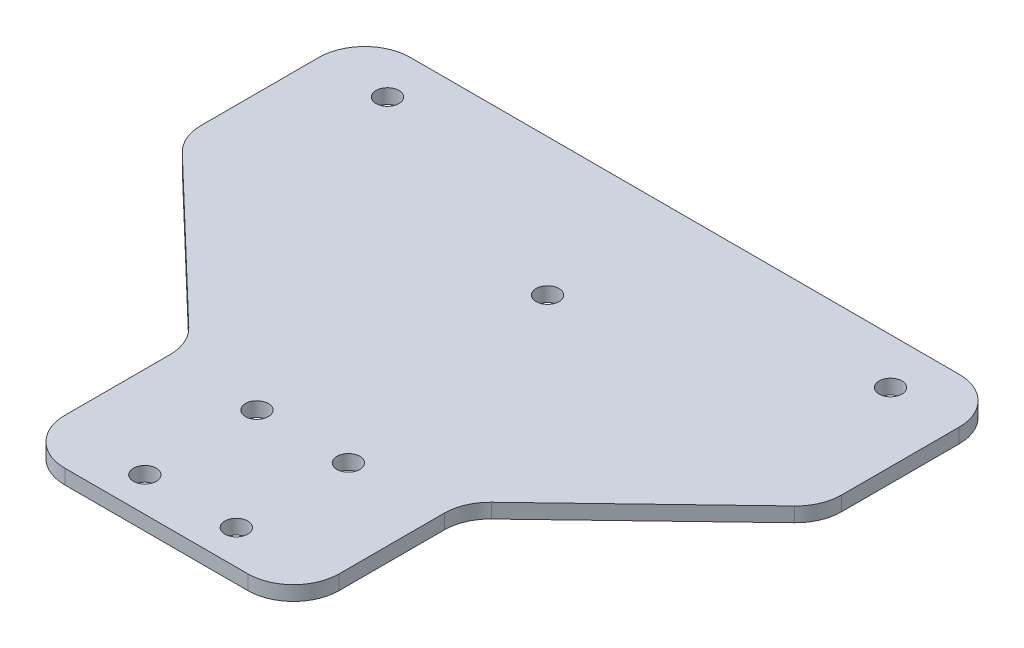
from build123d import *

# Parameters (mm, degrees)
SKETCH1_R           = 2.5
BOSS_EXTRUDE1_DEPTH = 3.18
CUT_EXTRUDE1_DEPTH  = 147.499595989
FILLET1_R           = 10


with BuildPart() as part:
    # Sketch1 → Boss-Extrude1 (new body)
    with BuildSketch(Plane(origin=(0, 0, 0), x_dir=(1, 0, 0), z_dir=(0, 1, 0))):
        Polygon((0, 0), (40, 0), (90, 0), (90, 40), (90, 75.550937794), (90, 115.550937794), (-50, 115.550937794), (-50, 0), align=None)
        with Locations(Location((-35, 105.550937794, 0), (0, 0, 90))):
            Circle(SKETCH1_R, mode=Mode.SUBTRACT)
        with Locations(Location((75, 105.550937794, 0), (0, 0, 90))):
            Circle(SKETCH1_R, mode=Mode.SUBTRACT)
        with Locations(Location((20, 85.550937794, 0), (0, 0, 90))):
            Circle(SKETCH1_R, mode=Mode.SUBTRACT)
        with Locations(Location((10, 7.5, 0), (0, 0, 90))):
            Circle(SKETCH1_R, mode=Mode.SUBTRACT)
        with Locations(Location((30, 7.5, 0), (0, 0, 90))):
            Circle(SKETCH1_R, mode=Mode.SUBTRACT)
        with Locations(Location((10, 32, 0), (0, 0, 90))):
            Circle(SKETCH1_R, mode=Mode.SUBTRACT)
        with Locations(Location((30, 32, 0), (0, 0, 90))):
            Circle(SKETCH1_R, mode=Mode.SUBTRACT)
    extrude(amount=BOSS_EXTRUDE1_DEPTH)

    # Sketch3 → Cut-Extrude1 (cut, through all)
    with BuildSketch(Plane.XZ):
        Polygon((90, -75.550937794), (50, -37.231146138), (50, 0), (90, 0), (90, -37.231146138), align=None)
        Polygon((-10, -37.231146138), (-50, -75.550937794), (-50, -37.231146138), (-50, 0), (-10, 0), align=None)
    extrude(amount=-CUT_EXTRUDE1_DEPTH, mode=Mode.SUBTRACT)

    # Fillet1
    fillet1_edges = [part.edges().sort_by_distance(p)[0] for p in [
        (-50, 1.59, -115.550937794),
        (90, 1.59, -115.550937794),
        (90, 1.59, -75.550937794),
        (50, 1.59, -37.231146138),
        (50, 1.59, 0),
        (-10, 1.59, 0),
        (-10, 1.59, -37.231146138),
        (-50, 1.59, -75.550937794),
    ]]
    fillet(fillet1_edges, radius=FILLET1_R)


solid = part.part
